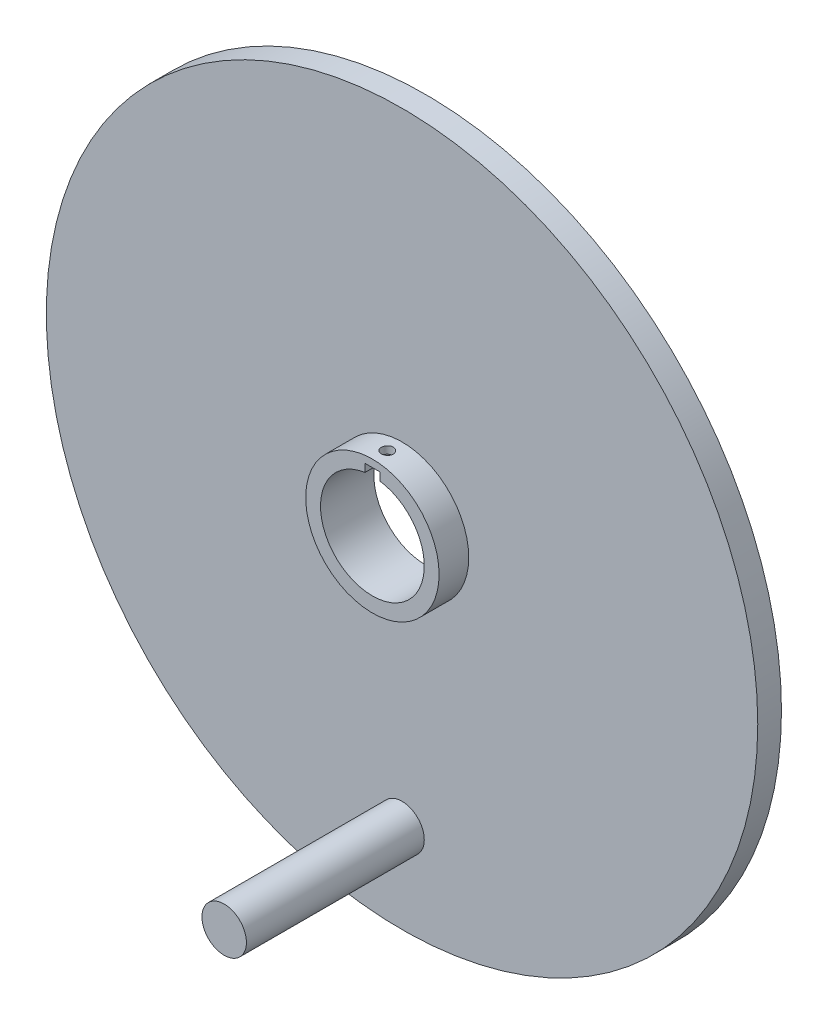
from build123d import *

# Parameters (mm, degrees)
SKETCH1_R           = 120
BOSS_EXTRUDE1_DEPTH = 8
SKETCH2_R           = 22.5
BOSS_EXTRUDE2_DEPTH = 10
SKETCH3_R           = 2
CUT_EXTRUDE1_DEPTH  = 25
SKETCH4_R           = 7.5
BOSS_EXTRUDE3_DEPTH = 60


with BuildPart() as part:
    # Sketch1 → Boss-Extrude1 (new body)
    with BuildSketch(Plane.XY):
        Circle(SKETCH1_R)
        with BuildLine():
            Line((-2.5, 20), (2.5, 20))
            Line((2.5, 20), (2.5, 17.320508076))
            ThreePointArc((2.5, 17.320508076), (0, -17.5), (-2.5, 17.320508076))
            Line((-2.5, 17.320508076), (-2.5, 20))
        make_face(mode=Mode.SUBTRACT)
    extrude(amount=BOSS_EXTRUDE1_DEPTH)

    # Sketch2 → Boss-Extrude2 (add)
    with BuildSketch(Plane.XY.offset(8)):
        Circle(SKETCH2_R)
        with BuildLine():
            Line((-2.5, 17.320508076), (-2.5, 20))
            Line((-2.5, 20), (2.5, 20))
            Line((2.5, 20), (2.5, 17.320508076))
            ThreePointArc((2.5, 17.320508076), (0, -17.5), (-2.5, 17.320508076))
        make_face(mode=Mode.SUBTRACT)
    extrude(amount=BOSS_EXTRUDE2_DEPTH)

    # Sketch3 → Cut-Extrude1 (cut)
    with BuildSketch(Plane(origin=(0, 0, 0), x_dir=(1, 0, 0), z_dir=(0, 1, 0))):
        with Locations(Location((0, -13, 0), (0, 0, 90))):
            Circle(SKETCH3_R)
    extrude(amount=CUT_EXTRUDE1_DEPTH, mode=Mode.SUBTRACT)

    # Sketch4 → Boss-Extrude3 (add)
    with BuildSketch(Plane.XY.offset(8)):
        with Locations((0, -90)):
            Circle(SKETCH4_R)
    extrude(amount=BOSS_EXTRUDE3_DEPTH)


solid = part.part
